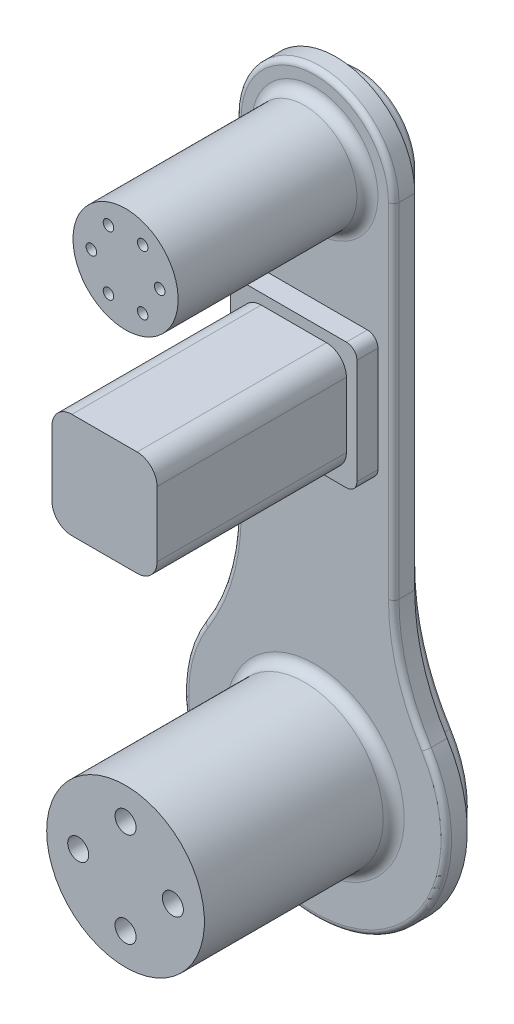
from build123d import *

# Parameters (mm, degrees)
SKETCH1_R             = 50
BOSS_EXTRUDE1_DEPTH   = 90
SKETCH1_R_2           = 75
BOSS_EXTRUDE1_2_DEPTH = 90
SKETCH2_R             = 10
SKETCH2_R_2           = 5
CUT_EXTRUDE1_DEPTH    = 40
BOSS_EXTRUDE2_DEPTH   = 20
BOSS_EXTRUDE3_DEPTH   = 20
FILLET1_R             = 19
SKETCH5_W             = 120
SKETCH5_H             = 120
BOSS_EXTRUDE4_DEPTH   = 20
SKETCH6_W             = 100
SKETCH6_H             = 100
BOSS_EXTRUDE5_DEPTH   = 180
FILLET2_R             = 19
FILLET3_R             = 10
FILLET4_R             = 10
FILLET5_R             = 5
SKETCH7_W             = 30
SKETCH7_H             = 5.384615385
BOSS_EXTRUDE6_DEPTH   = 0.1


with BuildPart() as part:
    # Sketch1 → Boss-Extrude1 (new, symmetric)
    with BuildSketch(Plane.XY):
        with Locations(Location((0, 250, 0), (0, 0, 180))):
            Circle(SKETCH1_R)
    extrude(amount=BOSS_EXTRUDE1_DEPTH, both=True)


with BuildPart() as body_2:
    # Sketch1 → Boss-Extrude1 2 (new, symmetric)
    with BuildSketch(Plane.XY):
        with Locations(Location((0, -250, 0), (0, 0, 180))):
            Circle(SKETCH1_R_2)
    extrude(amount=BOSS_EXTRUDE1_2_DEPTH, both=True)


with BuildPart() as cut_extrude1_tool:
    # Sketch2 → Cut-Extrude1 (new body)
    with BuildSketch(Plane.XY.offset(90)):
        with Locations((-45, -250)):
            Circle(SKETCH2_R)
        with Locations((0, -205)):
            Circle(SKETCH2_R)
        with Locations((45, -250)):
            Circle(SKETCH2_R)
        with Locations((0, -295)):
            Circle(SKETCH2_R)
        with Locations((-32.5, 250)):
            Circle(SKETCH2_R_2)
        with Locations((-16.25, 278.145825623)):
            Circle(SKETCH2_R_2)
        with Locations((16.25, 278.145825623)):
            Circle(SKETCH2_R_2)
        with Locations((32.5, 250)):
            Circle(SKETCH2_R_2)
        with Locations((16.25, 221.854174377)):
            Circle(SKETCH2_R_2)
        with Locations((-16.25, 221.854174377)):
            Circle(SKETCH2_R_2)
    extrude(amount=-CUT_EXTRUDE1_DEPTH)


with BuildPart() as part_1:
    add(part.part)

    # Cut-Extrude1: cut by cut_extrude1_tool
    add(cut_extrude1_tool.part, mode=Mode.SUBTRACT)



with BuildPart() as body_2_1:
    add(body_2.part)

    # Cut-Extrude1: cut by cut_extrude1_tool
    add(cut_extrude1_tool.part, mode=Mode.SUBTRACT)


with BuildPart() as part_2:
    add(part_1.part)

    add(body_2_1.part)  # Boss-Extrude2 merges body 2
    # Sketch3 → Boss-Extrude2 (add)
    with BuildSketch(Plane(origin=(0, 0, -90), x_dir=(-1, 0, 0), z_dir=(0, 0, -1))):
        with BuildLine():
            Line((-75, 250), (-75, -76.794919243))
            ThreePointArc((-75, -76.794919243), (-82.846215434, -132.264938866), (-105.769230769, -183.382661247))
            ThreePointArc((-105.769230769, -183.382661247), (0, -375), (105.769230769, -183.382661247))
            ThreePointArc((105.769230769, -183.382661247), (82.846215434, -132.264938866), (75, -76.794919243))
            Line((75, -76.794919243), (75, 250))
            ThreePointArc((75, 250), (0, 325), (-75, 250))
        make_face()
    extrude(amount=BOSS_EXTRUDE2_DEPTH)

    # Sketch4 → Boss-Extrude3 (add)
    with BuildSketch(Plane(origin=(0, 0, -110), x_dir=(-1, 0, 0), z_dir=(0, 0, -1))):
        with BuildLine():
            Line((-55, 250), (-55, -76.794919243))
            ThreePointArc((-55, -76.794919243), (-63.630836977, -137.811940828), (-88.846153846, -194.041435448))
            ThreePointArc((-88.846153846, -194.041435448), (0, -355), (88.846153846, -194.041435448))
            ThreePointArc((88.846153846, -194.041435448), (63.630836977, -137.811940828), (55, -76.794919243))
            Line((55, -76.794919243), (55, 250))
            ThreePointArc((55, 250), (0, 305), (-55, 250))
        make_face()
    extrude(amount=BOSS_EXTRUDE3_DEPTH)

    # Fillet1
    fillet1_edges = [part_2.edges().sort_by_distance(p)[0] for p in [
        (0, 305, -110),
        (55, 86.602540378, -110),
        (63.630836977, -137.811940828, -110),
        (0, -355, -110),
        (-63.630836977, -137.811940828, -110),
        (-55, 86.602540378, -110),
    ]]
    fillet(fillet1_edges, radius=FILLET1_R)

    # Sketch5 → Boss-Extrude4 (add)
    with BuildSketch(Plane.XY.offset(-90)):
        with Locations((0, 75)):
            Rectangle(SKETCH5_W, SKETCH5_H)
    extrude(amount=BOSS_EXTRUDE4_DEPTH)

    # Sketch6 → Boss-Extrude5 (add)
    with BuildSketch(Plane.XY.offset(-70)):
        with Locations((0, 75)):
            Rectangle(SKETCH6_W, SKETCH6_H)
    extrude(amount=BOSS_EXTRUDE5_DEPTH)

    # Fillet2
    fillet2_edges = [part_2.edges().sort_by_distance(p)[0] for p in [
        (-50, 25, 20),
        (50, 25, 20),
        (50, 125, 20),
        (-50, 125, 20),
    ]]
    fillet(fillet2_edges, radius=FILLET2_R)

    # Fillet3
    fillet3_edges = [part_2.edges().sort_by_distance(p)[0] for p in [
        (60, 15, -80),
        (60, 135, -80),
        (-60, 135, -80),
        (-60, 15, -80),
    ]]
    fillet(fillet3_edges, radius=FILLET3_R)

    # Fillet4
    fillet4_edges = [part_2.edges().sort_by_distance(p)[0] for p in [
        (50, 250, -90),
        (75, -250, -90),
    ]]
    fillet(fillet4_edges, radius=FILLET4_R)

    # Fillet5
    fillet5_edges = [part_2.edges().sort_by_distance(p)[0] for p in [
        (0, 325, -90),
        (75, 86.602540378, -90),
        (82.846215434, -132.264938866, -90),
        (0, -375, -90),
        (-82.846215434, -132.264938866, -90),
        (-75, 86.602540378, -90),
    ]]
    fillet(fillet5_edges, radius=FILLET5_R)

    # Sketch7 → Boss-Extrude6 (add)
    # profile 1 of 20: a face of its own
    with BuildSketch(Plane(origin=(0, 0, -130), x_dir=(-1, 0, 0), z_dir=(0, 0, -1))):
        with BuildLine():
            Line((14.327688402, 228.262161802), (10.643794171, 232.28860411))
            add(Edge.make_bspline(
                [(10.643794171, 232.28860411), (10.887132292, 232.461046445), (11.354307549, 232.79211168), (11.979183336, 233.329273303), (12.515745884, 233.863225768), (12.94865425, 234.404886272), (13.297159125, 234.944929129), (13.537536989, 235.494827833), (13.692125433, 236.048256179), (13.711281692, 236.420269874), (13.720717248, 236.603507956)],
                knots=[0, 0, 0, 0, 1.299459705, 2.494781419, 3.587730629, 4.594196874, 5.512431013, 6.380462003, 7.202284646, 8, 8, 8, 8], degree=3))
            add(Edge.make_bspline(
                [(13.720717248, 236.603507956), (13.714723626, 236.774412835), (13.703151517, 237.104385255), (13.588125612, 237.57478542), (13.389607792, 237.992413385), (13.130029042, 238.356861565), (12.817296827, 238.645558293), (12.489321145, 238.876060243), (12.127310165, 239.005852209), (11.87866642, 239.022935386), (11.755573017, 239.031392571)],
                knots=[0, 0, 0, 0, 1.185010067, 2.2879431, 3.333075148, 4.379039566, 5.372662701, 6.27520591, 7.14612461, 8, 8, 8, 8], degree=3))
            add(Edge.make_bspline(
                [(11.755573017, 239.031392571), (11.630704553, 239.026092882), (11.379236818, 239.015420043), (11.010679534, 238.912334953), (10.650556165, 238.756956288), (10.431331934, 238.608485629), (10.319274941, 238.532594494)],
                knots=[0, 0, 0, 0, 0.967525499, 1.948461899, 2.951351359, 4, 4, 4, 4], degree=3))
            add(Edge.make_bspline(
                [(10.319274941, 238.532594494), (10.232184693, 238.463591154), (10.031714444, 238.304754579), (9.713918296, 238.002165222), (9.327217397, 237.621637246), (8.873729933, 237.155355526), (8.359364181, 236.603892123), (7.781111458, 235.962366439), (7.135342251, 235.239842186), (6.685043323, 234.726874794), (6.449082633, 234.458075264)],
                knots=[0, 0, 0, 0, 0.473868417, 1.090782513, 1.870421581, 2.78911798, 3.865477667, 5.087766164, 6.473963263, 8, 8, 8, 8], degree=3))
            add(Edge.make_bspline(
                [(6.449082633, 234.458075264), (6.230680375, 234.20571826), (5.816198264, 233.726797095), (5.227907457, 233.045387383), (4.698636562, 232.446541733), (4.236328803, 231.921536332), (3.836133513, 231.478329749), (3.496137763, 231.115058742), (3.222960646, 230.827286572), (3.057961501, 230.663704942), (2.987544171, 230.593892571)],
                knots=[0, 0, 0, 0, 1.543621617, 2.929473131, 4.163658386, 5.240097082, 6.164993805, 6.925417477, 7.541396219, 8, 8, 8, 8], degree=3))
            add(Edge.make_bspline(
                [(2.987544171, 230.593892571), (2.701018696, 230.328887987), (2.15021611, 229.819456111), (1.294119375, 229.159075761), (0.464124305, 228.607294542), (-0.365271705, 228.184894207), (-1.204030905, 227.875704175), (-2.066595969, 227.649246351), (-2.967771884, 227.51552202), (-3.582527352, 227.500519287), (-3.893465444, 227.492931033)],
                knots=[0, 0, 0, 0, 1.20648512, 2.3192881, 3.339983362, 4.284774958, 5.190427137, 6.099526693, 7.038756749, 8, 8, 8, 8], degree=3))
            add(Edge.make_bspline(
                [(-3.893465444, 227.492931033), (-4.196449546, 227.498304738), (-4.79091563, 227.508848147), (-5.660868536, 227.637844871), (-6.493296904, 227.822049515), (-7.279861016, 228.105887322), (-8.029884008, 228.45474577), (-8.743611736, 228.879922209), (-9.40440547, 229.399734863), (-10.030003003, 229.97712524), (-10.591811141, 230.625648636), (-11.086121966, 231.323438532), (-11.506765207, 232.069191934), (-11.839911806, 232.865691131), (-12.107431108, 233.70806053), (-12.297527639, 234.597365031), (-12.414996788, 235.534644668), (-12.426997783, 236.174468433), (-12.433128906, 236.501344494)],
                knots=[0, 0, 0, 0, 1.043082113, 2.046565928, 3.024368146, 3.976196322, 4.921091788, 5.871642728, 6.831173094, 7.81279273, 8.801063391, 9.781590382, 10.755046466, 11.74476232, 12.751114423, 13.796272686, 14.874149815, 16, 16, 16, 16], degree=3))
            add(Edge.make_bspline(
                [(-12.433128906, 236.501344494), (-12.428578519, 236.757924459), (-12.419566145, 237.266099938), (-12.345941557, 238.015063112), (-12.227233578, 238.738312539), (-12.05669054, 239.434843832), (-11.842565518, 240.106720664), (-11.576099771, 240.753318527), (-11.262466454, 241.373952748), (-10.901487174, 241.972619611), (-10.482579565, 242.545192682), (-10.014454124, 243.099369724), (-9.486963274, 243.628228748), (-8.910394546, 244.14261666), (-8.2699719, 244.624345571), (-7.58416931, 245.098115556), (-6.836820035, 245.540993736), (-6.312644817, 245.814677767), (-6.044907752, 245.954469494)],
                knots=[0, 0, 0, 0, 1.016957334, 2.014158747, 2.980235577, 3.920141478, 4.854360818, 5.773095257, 6.689355356, 7.608638744, 8.541033765, 9.498850575, 10.481527934, 11.499755671, 12.559141621, 13.65604909, 14.802761907, 16, 16, 16, 16], degree=3))
            Line((-6.044907752, 245.954469494), (-3.202359675, 241.218892571))
            add(Edge.make_bspline(
                [(-3.202359675, 241.218892571), (-3.506285507, 241.044045623), (-4.088937304, 240.70884908), (-4.871803838, 240.140827201), (-5.542199437, 239.558917784), (-6.088274815, 238.949667605), (-6.517331701, 238.320484918), (-6.823965518, 237.668330625), (-7.013771504, 236.992746535), (-7.036951198, 236.532569344), (-7.048513521, 236.303027187)],
                knots=[0, 0, 0, 0, 1.283663364, 2.460892379, 3.537111102, 4.529833553, 5.449777664, 6.316464042, 7.160231139, 8, 8, 8, 8], degree=3))
            add(Edge.make_bspline(
                [(-7.048513521, 236.303027187), (-7.039160828, 236.069506953), (-7.02101524, 235.61644369), (-6.850102198, 234.96868925), (-6.587773223, 234.372200673), (-6.206256067, 233.859371976), (-5.771215535, 233.423881827), (-5.280558321, 233.111680146), (-4.756051837, 232.909165824), (-4.390045606, 232.888127493), (-4.205965444, 232.877546418)],
                knots=[0, 0, 0, 0, 1.13537643, 2.202795631, 3.242191317, 4.290390765, 5.297919085, 6.223733717, 7.106639842, 8, 8, 8, 8], degree=3))
            add(Edge.make_bspline(
                [(-4.205965444, 232.877546418), (-4.034794762, 232.887450607), (-3.687077907, 232.907570018), (-3.169778716, 233.05495688), (-2.654987889, 233.287300967), (-2.228273623, 233.5539431), (-1.872589537, 233.831931884), (-1.569039356, 234.104414145), (-1.226652759, 234.427352753), (-0.854766255, 234.808976363), (-0.446229652, 235.241862456), (-0.002014278, 235.727428213), (0.474258852, 236.270902724), (0.798678152, 236.655047016), (0.968313402, 236.855911802)],
                knots=[0, 0, 0, 0, 0.916057066, 1.860882232, 2.859899639, 3.934694552, 4.546382938, 5.276161949, 6.118633209, 7.067046139, 8.129668089, 9.306861125, 10.591787583, 12, 12, 12, 12], degree=3))
            add(Edge.make_bspline(
                [(0.968313402, 236.855911802), (1.291406108, 237.237749136), (1.911518804, 237.970610552), (2.827220759, 239.006426725), (3.683678238, 239.939122162), (4.487687705, 240.762554339), (5.2342889, 241.478919129), (5.916369547, 242.09689314), (6.547767247, 242.603020029), (7.296877393, 243.135086002), (8.204923209, 243.648744526), (9.303228434, 244.084422702), (10.399053091, 244.368667917), (11.134954346, 244.400393069), (11.497159556, 244.416007956)],
                knots=[0, 0, 0, 0, 1.34561873, 2.582649632, 3.719171478, 4.751946187, 5.678152813, 6.502542634, 7.227205346, 7.853698961, 8.973370308, 10.023159194, 11.027013428, 12, 12, 12, 12], degree=3))
            add(Edge.make_bspline(
                [(11.497159556, 244.416007956), (11.753998525, 244.409490082), (12.259998882, 244.39664917), (13.004083923, 244.282441403), (13.721731922, 244.110969132), (14.412724411, 243.86451858), (15.069414467, 243.534086781), (15.701907614, 243.143323007), (16.30910173, 242.684161379), (16.871198675, 242.151218587), (17.39335808, 241.573073165), (17.851696396, 240.953850805), (18.237168839, 240.300017179), (18.561628537, 239.616197323), (18.805812589, 238.893603601), (18.980446733, 238.138803005), (19.084041174, 237.351578058), (19.098147059, 236.816156773), (19.105332633, 236.543411802)],
                knots=[0, 0, 0, 0, 1.010961173, 1.991702108, 2.958025473, 3.913824419, 4.873522744, 5.847800578, 6.838738273, 7.865764422, 8.893759806, 9.903642949, 10.894078012, 11.878777586, 12.879248405, 13.891624672, 14.925988217, 16, 16, 16, 16], degree=3))
            add(Edge.make_bspline(
                [(19.105332633, 236.543411802), (19.092367135, 236.189961797), (19.066538485, 235.485851797), (18.865630042, 234.44449176), (18.546321032, 233.426854052), (18.170270145, 232.604218827), (17.794189874, 231.955445355), (17.455513984, 231.456552806), (17.065107674, 230.947912956), (16.621414933, 230.426904494), (16.127398987, 229.896175134), (15.573013913, 229.360190598), (14.976330493, 228.805894222), (14.547690166, 228.446581058), (14.327688402, 228.262161802)],
                knots=[0, 0, 0, 0, 1.282867522, 2.555608537, 3.83715526, 5.14906667, 5.830341525, 6.558732832, 7.337173124, 8.157810814, 9.043130442, 9.96912168, 10.957641678, 12, 12, 12, 12], degree=3))
        make_face()
    # profile 2 of 20: a face of its own
    with BuildSketch(Plane(origin=(0, 0, -130), x_dir=(-1, 0, 0), z_dir=(0, 0, -1))):
        with BuildLine():
            add(Edge.make_bspline(
                [(19.105332633, 208.009757956), (19.091835872, 207.488166962), (19.06519021, 206.458428201), (18.842829144, 204.944127291), (18.481142604, 203.484534115), (17.975570025, 202.079957956), (17.322972151, 200.732306594), (16.520662111, 199.445034816), (15.581129769, 198.209832303), (14.506100894, 197.049502774), (13.331355812, 195.985168369), (12.078863852, 195.049371952), (10.762599621, 194.257162028), (9.38373024, 193.609312149), (7.939384089, 193.107653274), (6.430315341, 192.757482802), (4.85930935, 192.531987739), (3.789610365, 192.50609201), (3.245957633, 192.492931033)],
                knots=[0, 0, 0, 0, 1.014244935, 2.002349224, 2.970143685, 3.935298574, 4.900830986, 5.877310296, 6.881148894, 7.915268703, 8.949887647, 9.960720774, 10.951801935, 11.933244874, 12.919141415, 13.920101769, 14.942934067, 16, 16, 16, 16], degree=3))
            add(Edge.make_bspline(
                [(3.245957633, 192.492931033), (2.70843001, 192.506946817), (1.649214585, 192.53456537), (0.092694688, 192.748292993), (-1.400240519, 193.104327436), (-2.830446634, 193.597671974), (-4.198234103, 194.233049267), (-5.50217447, 195.011275234), (-6.737297079, 195.939452004), (-7.900571267, 196.986997526), (-8.956167781, 198.140278433), (-9.888944763, 199.362245215), (-10.67368338, 200.650467809), (-11.321807334, 201.995841727), (-11.822873451, 203.404249425), (-12.176748737, 204.872493691), (-12.391723628, 206.400823274), (-12.419188342, 207.440148857), (-12.433128906, 207.967690648)],
                knots=[0, 0, 0, 0, 1.051446269, 2.071908608, 3.067230498, 4.050151293, 5.026863609, 6.012936299, 7.01551645, 8.045060801, 9.071444569, 10.070117656, 11.048150216, 12.017576978, 12.987003741, 13.967083865, 14.968130643, 16, 16, 16, 16], degree=3))
            add(Edge.make_bspline(
                [(-12.433128906, 207.967690648), (-12.420625121, 208.519437236), (-12.396056894, 209.603543865), (-12.162424272, 211.190138769), (-11.810491928, 212.71023378), (-11.285251784, 214.151059225), (-10.628657439, 215.52728868), (-9.820022138, 216.828810583), (-8.860682212, 218.055187536), (-7.775206715, 219.199384841), (-6.58745844, 220.23603037), (-5.332707715, 221.151073389), (-4.020539734, 221.922932474), (-2.650340373, 222.551635865), (-1.230625087, 223.047280364), (0.247252597, 223.396901242), (1.779748195, 223.603430638), (2.820649839, 223.632198984), (3.348121094, 223.646777187)],
                knots=[0, 0, 0, 0, 1.067978421, 2.098431617, 3.099715153, 4.085208694, 5.062210972, 6.048429807, 7.046490867, 8.072918869, 9.098532598, 10.095778865, 11.076610158, 12.041847152, 13.011192615, 13.984257998, 14.978533688, 16, 16, 16, 16], degree=3))
            add(Edge.make_bspline(
                [(3.348121094, 223.646777187), (3.702961264, 223.642139908), (4.408148514, 223.632924069), (5.453462305, 223.524296523), (6.476909827, 223.363289975), (7.480250136, 223.142509729), (8.45971511, 222.846943119), (9.41738548, 222.482957014), (10.356980848, 222.064239939), (11.269433183, 221.576287119), (12.145940354, 221.033397287), (12.982487348, 220.441149532), (13.768890765, 219.797923886), (14.510472597, 219.105922542), (15.201811489, 218.362368942), (15.855795009, 217.577230019), (16.446057732, 216.73088188), (17.00008516, 215.850849019), (17.496534714, 214.938659042), (17.924330512, 213.99953985), (18.293266929, 213.04789502), (18.586138201, 212.072294097), (18.824360483, 211.084073505), (18.981974374, 210.072894987), (19.091500721, 209.04783538), (19.100711054, 208.356604953), (19.105332633, 208.009757956)],
                knots=[0, 0, 0, 0, 1.034751683, 2.056401036, 3.062285641, 4.056148242, 5.050783641, 6.043890034, 7.043081327, 8.049576835, 9.059882113, 10.048974407, 11.037410495, 12.021414423, 13.005418351, 13.997561464, 14.999568372, 16.012961702, 17.030138968, 18.026421002, 19.021605583, 20.005054086, 20.995836695, 21.984410968, 22.988613675, 24, 24, 24, 24], degree=3))
        make_face()
        with BuildLine():
            add(Edge.make_bspline(
                [(13.720717248, 208.093892571), (13.711298372, 208.44492038), (13.692709279, 209.137708804), (13.551085878, 210.153903546), (13.324896323, 211.12948527), (12.997266663, 212.059051177), (12.580266026, 212.946610724), (12.075401919, 213.793809726), (11.465127203, 214.588641535), (10.782935356, 215.342764077), (10.019676886, 216.021692334), (9.210627194, 216.632140801), (8.336319184, 217.125713163), (7.425550198, 217.550114932), (6.455287852, 217.86360128), (5.441279426, 218.102288443), (4.373115401, 218.232293241), (3.64691906, 218.252063771), (3.27600571, 218.262161802)],
                knots=[0, 0, 0, 0, 1.033668485, 2.040047952, 3.016132939, 3.979056467, 4.937231767, 5.900589077, 6.877725736, 7.88429546, 8.891280164, 9.882584218, 10.863295226, 11.842887319, 12.837417301, 13.860812229, 14.907384602, 16, 16, 16, 16], degree=3))
            add(Edge.make_bspline(
                [(3.27600571, 218.262161802), (2.86482407, 218.249914934), (2.058976185, 218.225913102), (0.88299554, 218.058721976), (-0.225263982, 217.768335584), (-1.2696267, 217.364310178), (-2.244756483, 216.838791932), (-3.1559124, 216.20167889), (-3.998650486, 215.447318201), (-4.490955198, 214.866863776), (-4.740821213, 214.572257956)],
                knots=[0, 0, 0, 0, 1.078379799, 2.113445728, 3.107478808, 4.077334175, 5.043482131, 6.005506737, 6.987708079, 8, 8, 8, 8], degree=3))
            add(Edge.make_bspline(
                [(-4.740821213, 214.572257956), (-4.925392694, 214.330875569), (-5.290377229, 213.85354918), (-5.758179786, 213.091632342), (-6.159133243, 212.307008027), (-6.483098893, 211.493755261), (-6.737924828, 210.653591592), (-6.91637524, 209.786632233), (-7.028368306, 208.894105591), (-7.041753599, 208.290537247), (-7.048513521, 207.985719494)],
                knots=[0, 0, 0, 0, 1.023928204, 2.024787132, 3.009472467, 3.9914905, 4.972207045, 5.96565515, 6.972602802, 8, 8, 8, 8], degree=3))
            add(Edge.make_bspline(
                [(-7.048513521, 207.985719494), (-7.039015284, 207.640727231), (-7.020327203, 206.961944104), (-6.880440116, 205.964671895), (-6.643738155, 205.009230338), (-6.318885516, 204.089803982), (-5.897013317, 203.208612151), (-5.374264343, 202.370236503), (-4.765803565, 201.568544167), (-4.071849411, 200.815740514), (-3.308228971, 200.128237807), (-2.490745097, 199.526665274), (-1.62974897, 199.015662478), (-0.724622962, 198.601380794), (0.224333421, 198.27212151), (1.218460063, 198.048711857), (2.254182277, 197.904734706), (2.959008145, 197.88672251), (3.318073017, 197.877546418)],
                knots=[0, 0, 0, 0, 1.026250569, 2.01918027, 2.989144455, 3.950556051, 4.91558185, 5.889785058, 6.885144561, 7.905911388, 8.931486752, 9.937601838, 10.920932928, 11.905004308, 12.894547393, 13.903711934, 14.932071819, 16, 16, 16, 16], degree=3))
            add(Edge.make_bspline(
                [(3.318073017, 197.877546418), (3.675074851, 197.887037056), (4.377778514, 197.905717931), (5.41081389, 198.045844234), (6.400639874, 198.281070612), (7.348872955, 198.606803636), (8.256442755, 199.022747459), (9.120157722, 199.537104192), (9.939182853, 200.148069022), (10.707936807, 200.841580631), (11.414372447, 201.596425392), (12.027430166, 202.406826668), (12.560157832, 203.250108519), (12.977475174, 204.145619946), (13.309951016, 205.075039535), (13.554790996, 206.044038654), (13.691714401, 207.056287446), (13.710963458, 207.744941229), (13.720717248, 208.093892571)],
                knots=[0, 0, 0, 0, 1.055025985, 2.07665775, 3.074803781, 4.057872707, 5.035505728, 6.020516407, 7.023567878, 8.050795229, 9.077271434, 10.074415901, 11.050397877, 12.019801805, 12.988065821, 13.964604439, 14.968634123, 16, 16, 16, 16], degree=3))
        make_face(mode=Mode.SUBTRACT)
    # profile 3 of 20: a face of its own
    with BuildSketch(Plane(origin=(0, 0, -130), x_dir=(-1, 0, 0), z_dir=(0, 0, -1))):
        Polygon((18.336101864, 187.108315648), (18.336101864, 181.723700264), (-6.279282752, 181.723700264), (-6.279282752, 173.262161802), (-11.663898136, 173.262161802), (-11.663898136, 187.108315648), align=None)
    # profile 4 of 20: a face of its own
    with BuildSketch(Plane(origin=(0, 0, -130), x_dir=(-1, 0, 0), z_dir=(0, 0, -1))):
        with Locations((3.336101864, 166.723700264)):
            Rectangle(SKETCH7_W, SKETCH7_H)
    # profile 5 of 20: a face of its own
    with BuildSketch(Plane(origin=(0, 0, -130), x_dir=(-1, 0, 0), z_dir=(0, 0, -1))):
        with BuildLine():
            Line((18.336101864, 157.108315648), (18.336101864, 150.323459879))
            add(Edge.make_bspline(
                [(18.336101864, 150.323459879), (18.332404071, 149.794502415), (18.325256195, 148.772021657), (18.244723827, 147.290647969), (18.120857499, 145.913163817), (17.95050018, 144.638659632), (17.724928377, 143.46982044), (17.44245739, 142.407914446), (17.114295677, 141.448435908), (16.732932275, 140.580114235), (16.285441352, 139.78962189), (15.782762382, 139.044336658), (15.217286351, 138.335666982), (14.587714937, 137.659682253), (13.898229219, 137.014735987), (13.134947189, 136.41596751), (12.31763849, 135.844180806), (11.443466555, 135.308653148), (10.514157187, 134.831966649), (9.544337057, 134.407662221), (8.533375842, 134.054139998), (7.482669424, 133.766289652), (6.395261448, 133.537000943), (5.269079996, 133.376531685), (4.105133896, 133.277338241), (3.316271755, 133.267275144), (2.915428787, 133.262161802)],
                knots=[0, 0, 0, 0, 1.443473934, 2.790251435, 4.047465151, 5.217279069, 6.298047006, 7.293970747, 8.213772908, 9.063072335, 9.878180301, 10.689410498, 11.514196541, 12.349783386, 13.208549609, 14.087984609, 14.994942826, 15.929749014, 16.883358292, 17.843153412, 18.816615524, 19.8034191, 20.814532747, 21.847477555, 22.906243002, 24, 24, 24, 24], degree=3))
            add(Edge.make_bspline(
                [(2.915428787, 133.262161802), (2.349812523, 133.275549938), (1.2363638, 133.301905266), (-0.397599283, 133.523931829), (-1.963954594, 133.882965405), (-3.450268661, 134.388003592), (-4.843956056, 135.013406415), (-6.117098738, 135.762403513), (-7.272292095, 136.613479469), (-8.290368219, 137.574186681), (-9.170778392, 138.612755428), (-9.915993488, 139.696266109), (-10.514193909, 140.823745354), (-10.887664762, 141.819314477), (-11.122606307, 142.685004994), (-11.258363257, 143.444026792), (-11.387678267, 144.307282748), (-11.483724834, 145.280324392), (-11.571757488, 146.361889887), (-11.619001132, 147.552727539), (-11.658459082, 148.850840089), (-11.662037612, 149.752507788), (-11.663898136, 150.221296418)],
                knots=[0, 0, 0, 0, 1.315357893, 2.589359008, 3.828307697, 5.048525571, 6.235260212, 7.375784434, 8.478395391, 9.566323578, 10.624275077, 11.640246088, 12.619991216, 13.585951757, 14.107079058, 14.704817694, 15.378369799, 16.137463096, 16.978827496, 17.902494345, 18.909479843, 20, 20, 20, 20], degree=3))
            Line((-11.663898136, 150.221296418), (-11.663898136, 157.108315648))
            Line((-11.663898136, 157.108315648), (18.336101864, 157.108315648))
        make_face()
        with BuildLine():
            Line((12.951486479, 151.723700264), (-6.279282752, 151.723700264))
            Line((-6.279282752, 151.723700264), (-6.279282752, 148.911200264))
            add(Edge.make_bspline(
                [(-6.279282752, 148.911200264), (-6.278669545, 148.576555957), (-6.277490144, 147.932923551), (-6.221314255, 147.003664051), (-6.164929153, 146.144334635), (-6.057908344, 145.357300833), (-5.938694693, 144.636834862), (-5.772792576, 143.992834035), (-5.598526456, 143.412022696), (-5.376664085, 142.901495348), (-5.126943222, 142.433893888), (-4.834366275, 142.000948367), (-4.50947063, 141.583034647), (-4.142700551, 141.187966338), (-3.738913111, 140.814246752), (-3.296026425, 140.464092633), (-2.815397033, 140.132808409), (-2.294462928, 139.828983273), (-1.738806112, 139.551084178), (-1.15349524, 139.305567545), (-0.535339504, 139.098306552), (0.115387488, 138.940912022), (0.794647686, 138.806832621), (1.506808524, 138.710017011), (2.249543331, 138.657271533), (2.755092836, 138.65030941), (3.011582633, 138.646777187)],
                knots=[0, 0, 0, 0, 1.502785267, 2.890356349, 4.180881464, 5.369512404, 6.456827674, 7.458527365, 8.354953631, 9.177280646, 9.954299195, 10.732931168, 11.52132839, 12.330004022, 13.151395147, 13.990341431, 14.86389591, 15.771318928, 16.696852441, 17.652725226, 18.620174565, 19.621874256, 20.657747019, 21.729235313, 22.847930884, 24, 24, 24, 24], degree=3))
            add(Edge.make_bspline(
                [(3.011582633, 138.646777187), (3.404606948, 138.653952586), (4.17097391, 138.667944059), (5.287204117, 138.802874794), (6.338302077, 139.022516291), (7.320366881, 139.335923546), (8.236158649, 139.730983103), (9.077918683, 140.225492231), (9.859787393, 140.798169161), (10.318456666, 141.251026452), (10.547640325, 141.477306033)],
                knots=[0, 0, 0, 0, 1.13821349, 2.219428113, 3.251817212, 4.244760574, 5.201143372, 6.134805572, 7.068016741, 8, 8, 8, 8], degree=3))
            add(Edge.make_bspline(
                [(10.547640325, 141.477306033), (10.742935785, 141.700439126), (11.141804649, 142.156163202), (11.619751552, 142.956264921), (12.039674753, 143.837935578), (12.372627021, 144.821345153), (12.635939869, 145.89698943), (12.817540301, 147.071274967), (12.934234814, 148.337913212), (12.945612723, 149.215410675), (12.951486479, 149.668411802)],
                knots=[0, 0, 0, 0, 0.813307809, 1.661089106, 2.549956539, 3.493439533, 4.508053171, 5.589449661, 6.755572447, 8, 8, 8, 8], degree=3))
            Line((12.951486479, 149.668411802), (12.951486479, 151.723700264))
        make_face(mode=Mode.SUBTRACT)
    # profile 6 of 20: a face of its own
    with BuildSketch(Plane(origin=(0, 0, -130), x_dir=(-1, 0, 0), z_dir=(0, 0, -1))):
        Polygon((18.336101864, 130.762161802), (18.336101864, 125.203267571), (-0.816542367, 120.762161802), (18.336101864, 115.672017571), (18.336101864, 110.437642571), (-0.816542367, 105.377546418), (18.336101864, 100.948459879), (18.336101864, 95.377546418), (-11.663898136, 102.318652187), (-11.663898136, 107.943652187), (7.72913071, 113.06985411), (-11.663898136, 118.22610411), (-11.663898136, 123.809036802), align=None)
    # profile 7 of 20: a face of its own
    with BuildSketch(Plane(origin=(0, 0, -130), x_dir=(-1, 0, 0), z_dir=(0, 0, -1))):
        with BuildLine():
            add(Edge.make_bspline(
                [(19.105332633, 76.471296418), (19.091835872, 75.949705423), (19.06519021, 74.919966663), (18.842829144, 73.405665753), (18.481142604, 71.946072576), (17.975570025, 70.541496418), (17.322972151, 69.193845055), (16.520662111, 67.906573278), (15.581129769, 66.671370764), (14.506100894, 65.511041236), (13.331355812, 64.446706831), (12.078863852, 63.510910413), (10.762599621, 62.71870049), (9.38373024, 62.07085061), (7.939384089, 61.569191735), (6.430315341, 61.219021263), (4.85930935, 60.9935262), (3.789610365, 60.967630471), (3.245957633, 60.954469494)],
                knots=[0, 0, 0, 0, 1.014244935, 2.002349224, 2.970143685, 3.935298574, 4.900830986, 5.877310296, 6.881148894, 7.915268703, 8.949887647, 9.960720774, 10.951801935, 11.933244874, 12.919141415, 13.920101769, 14.942934067, 16, 16, 16, 16], degree=3))
            add(Edge.make_bspline(
                [(3.245957633, 60.954469494), (2.70843001, 60.968485279), (1.649214585, 60.996103832), (0.092694688, 61.209831454), (-1.400240519, 61.565865898), (-2.830446634, 62.059210436), (-4.198234103, 62.694587729), (-5.50217447, 63.472813695), (-6.737297079, 64.400990465), (-7.900571267, 65.448535988), (-8.956167781, 66.601816894), (-9.888944763, 67.823783677), (-10.67368338, 69.11200627), (-11.321807334, 70.457380188), (-11.822873451, 71.865787887), (-12.176748737, 73.334032153), (-12.391723628, 74.862361736), (-12.419188342, 75.901687318), (-12.433128906, 76.42922911)],
                knots=[0, 0, 0, 0, 1.051446269, 2.071908608, 3.067230498, 4.050151293, 5.026863609, 6.012936299, 7.01551645, 8.045060801, 9.071444569, 10.070117656, 11.048150216, 12.017576978, 12.987003741, 13.967083865, 14.968130643, 16, 16, 16, 16], degree=3))
            add(Edge.make_bspline(
                [(-12.433128906, 76.42922911), (-12.420625121, 76.980975698), (-12.396056894, 78.065082326), (-12.162424272, 79.65167723), (-11.810491928, 81.171772242), (-11.285251784, 82.612597687), (-10.628657439, 83.988827142), (-9.820022138, 85.290349044), (-8.860682212, 86.516725997), (-7.775206715, 87.660923303), (-6.58745844, 88.697568832), (-5.332707715, 89.61261185), (-4.020539734, 90.384470935), (-2.650340373, 91.013174327), (-1.230625087, 91.508818825), (0.247252597, 91.858439704), (1.779748195, 92.0649691), (2.820649839, 92.093737445), (3.348121094, 92.108315648)],
                knots=[0, 0, 0, 0, 1.067978421, 2.098431617, 3.099715153, 4.085208694, 5.062210972, 6.048429807, 7.046490867, 8.072918869, 9.098532598, 10.095778865, 11.076610158, 12.041847152, 13.011192615, 13.984257998, 14.978533688, 16, 16, 16, 16], degree=3))
            add(Edge.make_bspline(
                [(3.348121094, 92.108315648), (3.702961264, 92.103678369), (4.408148514, 92.09446253), (5.453462305, 91.985834985), (6.476909827, 91.824828436), (7.480250136, 91.60404819), (8.45971511, 91.308481581), (9.41738548, 90.944495475), (10.356980848, 90.525778401), (11.269433183, 90.037825581), (12.145940354, 89.494935748), (12.982487348, 88.902687993), (13.768890765, 88.259462347), (14.510472597, 87.567461004), (15.201811489, 86.823907403), (15.855795009, 86.03876848), (16.446057732, 85.192420342), (17.00008516, 84.312387481), (17.496534714, 83.400197503), (17.924330512, 82.461078311), (18.293266929, 81.509433481), (18.586138201, 80.533832559), (18.824360483, 79.545611967), (18.981974374, 78.534433449), (19.091500721, 77.509373842), (19.100711054, 76.818143414), (19.105332633, 76.471296418)],
                knots=[0, 0, 0, 0, 1.034751683, 2.056401036, 3.062285641, 4.056148242, 5.050783641, 6.043890034, 7.043081327, 8.049576835, 9.059882113, 10.048974407, 11.037410495, 12.021414423, 13.005418351, 13.997561464, 14.999568372, 16.012961702, 17.030138968, 18.026421002, 19.021605583, 20.005054086, 20.995836695, 21.984410968, 22.988613675, 24, 24, 24, 24], degree=3))
        make_face()
        with BuildLine():
            add(Edge.make_bspline(
                [(13.720717248, 76.555431033), (13.711298372, 76.906458841), (13.692709279, 77.599247266), (13.551085878, 78.615442008), (13.324896323, 79.591023732), (12.997266663, 80.520589639), (12.580266026, 81.408149185), (12.075401919, 82.255348187), (11.465127203, 83.050179997), (10.782935356, 83.804302539), (10.019676886, 84.483230796), (9.210627194, 85.093679263), (8.336319184, 85.587251625), (7.425550198, 86.011653394), (6.455287852, 86.325139741), (5.441279426, 86.563826904), (4.373115401, 86.693831703), (3.64691906, 86.713602232), (3.27600571, 86.723700264)],
                knots=[0, 0, 0, 0, 1.033668485, 2.040047952, 3.016132939, 3.979056467, 4.937231767, 5.900589077, 6.877725736, 7.88429546, 8.891280164, 9.882584218, 10.863295226, 11.842887319, 12.837417301, 13.860812229, 14.907384602, 16, 16, 16, 16], degree=3))
            add(Edge.make_bspline(
                [(3.27600571, 86.723700264), (2.86482407, 86.711453395), (2.058976185, 86.687451563), (0.88299554, 86.520260438), (-0.225263982, 86.229874045), (-1.2696267, 85.82584864), (-2.244756483, 85.300330394), (-3.1559124, 84.663217351), (-3.998650486, 83.908856662), (-4.490955198, 83.328402238), (-4.740821213, 83.033796418)],
                knots=[0, 0, 0, 0, 1.078379799, 2.113445728, 3.107478808, 4.077334175, 5.043482131, 6.005506737, 6.987708079, 8, 8, 8, 8], degree=3))
            add(Edge.make_bspline(
                [(-4.740821213, 83.033796418), (-4.925392694, 82.79241403), (-5.290377229, 82.315087642), (-5.758179786, 81.553170803), (-6.159133243, 80.768546488), (-6.483098893, 79.955293722), (-6.737924828, 79.115130054), (-6.91637524, 78.248170694), (-7.028368306, 77.355644052), (-7.041753599, 76.752075708), (-7.048513521, 76.447257956)],
                knots=[0, 0, 0, 0, 1.023928204, 2.024787132, 3.009472467, 3.9914905, 4.972207045, 5.96565515, 6.972602802, 8, 8, 8, 8], degree=3))
            add(Edge.make_bspline(
                [(-7.048513521, 76.447257956), (-7.039015284, 76.102265693), (-7.020327203, 75.423482565), (-6.880440116, 74.426210357), (-6.643738155, 73.4707688), (-6.318885516, 72.551342443), (-5.897013317, 71.670150613), (-5.374264343, 70.831774965), (-4.765803565, 70.030082628), (-4.071849411, 69.277278975), (-3.308228971, 68.589776269), (-2.490745097, 67.988203735), (-1.62974897, 67.47720094), (-0.724622962, 67.062919256), (0.224333421, 66.733659971), (1.218460063, 66.510250319), (2.254182277, 66.366273168), (2.959008145, 66.348260971), (3.318073017, 66.339084879)],
                knots=[0, 0, 0, 0, 1.026250569, 2.01918027, 2.989144455, 3.950556051, 4.91558185, 5.889785058, 6.885144561, 7.905911388, 8.931486752, 9.937601838, 10.920932928, 11.905004308, 12.894547393, 13.903711934, 14.932071819, 16, 16, 16, 16], degree=3))
            add(Edge.make_bspline(
                [(3.318073017, 66.339084879), (3.675074851, 66.348575518), (4.377778514, 66.367256392), (5.41081389, 66.507382695), (6.400639874, 66.742609073), (7.348872955, 67.068342097), (8.256442755, 67.48428592), (9.120157722, 67.998642654), (9.939182853, 68.609607483), (10.707936807, 69.303119092), (11.414372447, 70.057963854), (12.027430166, 70.868365129), (12.560157832, 71.71164698), (12.977475174, 72.607158408), (13.309951016, 73.536577997), (13.554790996, 74.505577116), (13.691714401, 75.517825908), (13.710963458, 76.206479691), (13.720717248, 76.555431033)],
                knots=[0, 0, 0, 0, 1.055025985, 2.07665775, 3.074803781, 4.057872707, 5.035505728, 6.020516407, 7.023567878, 8.050795229, 9.077271434, 10.074415901, 11.050397877, 12.019801805, 12.988065821, 13.964604439, 14.968634123, 16, 16, 16, 16], degree=3))
        make_face(mode=Mode.SUBTRACT)
    # profile 8 of 20: a face of its own
    with BuildSketch(Plane(origin=(0, 0, -130), x_dir=(-1, 0, 0), z_dir=(0, 0, -1))):
        with BuildLine():
            Line((18.336101864, 55.56985411), (18.336101864, 49.295815648))
            add(Edge.make_bspline(
                [(18.336101864, 49.295815648), (18.334634394, 48.881102952), (18.331812037, 48.083493618), (18.287085721, 46.933395153), (18.225129544, 45.876833968), (18.129424688, 44.910436348), (18.005666941, 44.038025864), (17.855523635, 43.257754758), (17.685902548, 42.569169941), (17.478005606, 41.962971574), (17.238589246, 41.417416817), (16.968357047, 40.910307017), (16.65709783, 40.432703257), (16.317423656, 39.975839217), (15.937168616, 39.547869682), (15.519414225, 39.149980456), (15.06717165, 38.777055356), (14.583160337, 38.428600876), (14.06805597, 38.118516189), (13.529172611, 37.843796454), (12.96505407, 37.618088393), (12.378929803, 37.430152961), (11.770094988, 37.285454117), (11.138944916, 37.187208949), (10.485211282, 37.114565645), (10.041042526, 37.110426878), (9.814467248, 37.108315648)],
                knots=[0, 0, 0, 0, 1.749037589, 3.363891962, 4.853828513, 6.212420965, 7.458679178, 8.568887289, 9.562757098, 10.447168552, 11.268163578, 12.073310924, 12.867792413, 13.67045336, 14.472446998, 15.279188696, 16.101356728, 16.943088626, 17.792208908, 18.634830833, 19.491484118, 20.351879174, 21.228996054, 22.12769993, 23.044919519, 24, 24, 24, 24], degree=3))
            add(Edge.make_bspline(
                [(9.814467248, 37.108315648), (9.577979317, 37.113835324), (9.114269587, 37.124658402), (8.433117814, 37.18295739), (7.781439441, 37.289509625), (7.161142504, 37.450898487), (6.564506683, 37.636394022), (6.002540283, 37.8830555), (5.467070317, 38.161437358), (4.965671209, 38.492063357), (4.487205885, 38.854909238), (4.050006126, 39.276891365), (3.6305741, 39.730671779), (3.255181606, 40.241759128), (2.898445961, 40.787624208), (2.575148464, 41.379112783), (2.27716216, 42.012364596), (2.110984414, 42.457571981), (2.02600571, 42.685238725)],
                knots=[0, 0, 0, 0, 1.099860209, 2.156625411, 3.176576793, 4.16617041, 5.135385252, 6.078461593, 7.016046972, 7.938469504, 8.868247731, 9.803980173, 10.76021508, 11.73834243, 12.748633912, 13.790971185, 14.870363756, 16, 16, 16, 16], degree=3))
            Line((2.02600571, 42.685238725), (-11.663898136, 35.762161802))
            Line((-11.663898136, 35.762161802), (-11.663898136, 41.747738725))
            Line((-11.663898136, 41.747738725), (1.413024941, 48.358315648))
            Line((1.413024941, 48.358315648), (1.413024941, 50.185238725))
            Line((1.413024941, 50.185238725), (-11.663898136, 50.185238725))
            Line((-11.663898136, 50.185238725), (-11.663898136, 55.56985411))
            Line((-11.663898136, 55.56985411), (18.336101864, 55.56985411))
        make_face()
        with BuildLine():
            Line((6.797640325, 50.185238725), (6.797640325, 48.087882956))
            add(Edge.make_bspline(
                [(6.797640325, 48.087882956), (6.800528248, 47.831463738), (6.806058001, 47.340476033), (6.831708205, 46.634371876), (6.893509379, 45.993058632), (6.971601021, 45.413792145), (7.061743534, 44.893625887), (7.19101008, 44.437300651), (7.329270127, 44.037464178), (7.501915052, 43.699857323), (7.694797234, 43.410236689), (7.923584015, 43.167475438), (8.174207797, 42.953611507), (8.462442967, 42.785854789), (8.776480585, 42.650318173), (9.122228969, 42.566262738), (9.493427929, 42.499572714), (9.752017898, 42.495204276), (9.886582633, 42.492931033)],
                knots=[0, 0, 0, 0, 1.688935225, 3.233948049, 4.651771667, 5.929878493, 7.083962697, 8.124219224, 9.050753627, 9.864999381, 10.615157594, 11.334035464, 12.05533055, 12.777108108, 13.522027315, 14.29964284, 15.115170198, 16, 16, 16, 16], degree=3))
            add(Edge.make_bspline(
                [(9.886582633, 42.492931033), (10.045575376, 42.499038425), (10.357887157, 42.511035266), (10.807500438, 42.630087803), (11.223672196, 42.81957893), (11.604405607, 43.07937314), (11.938527037, 43.4063487), (12.230659851, 43.780944812), (12.467046052, 44.208687602), (12.6184395, 44.607564735), (12.711495704, 44.972982479), (12.777553582, 45.301688409), (12.828772264, 45.683366039), (12.878355717, 46.115885639), (12.912485257, 46.601107235), (12.936633657, 47.138134686), (12.946653643, 47.727271501), (12.94982915, 48.13796232), (12.951486479, 48.352306033)],
                knots=[0, 0, 0, 0, 1.020213939, 2.004021227, 2.966357326, 3.948562114, 4.950324333, 5.960000531, 6.991850424, 8.080015304, 8.69218159, 9.414443227, 10.233931419, 11.166782034, 12.212677862, 13.359889063, 14.622099264, 16, 16, 16, 16], degree=3))
            Line((12.951486479, 48.352306033), (12.951486479, 50.185238725))
            Line((12.951486479, 50.185238725), (6.797640325, 50.185238725))
        make_face(mode=Mode.SUBTRACT)
    # profile 9 of 20: a face of its own
    with BuildSketch(Plane(origin=(0, 0, -130), x_dir=(-1, 0, 0), z_dir=(0, 0, -1))):
        Polygon((18.336101864, 31.339084879), (18.336101864, 25.954469494), (7.777207633, 25.954469494), (18.336101864, 17.44485411), (18.336101864, 10.64797911), (5.066871094, 21.339084879), (-11.663898136, 9.608315648), (-11.663898136, 16.092690648), (2.404611479, 25.954469494), (-11.663898136, 25.954469494), (-11.663898136, 31.339084879), align=None)
    # profile 10 of 20: a face of its own
    with BuildSketch(Plane(origin=(0, 0, -130), x_dir=(-1, 0, 0), z_dir=(0, 0, -1))):
        with BuildLine():
            Line((14.327688402, -9.814761275), (10.643794171, -5.788318967))
            add(Edge.make_bspline(
                [(10.643794171, -5.788318967), (10.887132292, -5.615876632), (11.354307549, -5.284811397), (11.979183336, -4.747649774), (12.515745884, -4.213697309), (12.94865425, -3.672036805), (13.297159125, -3.131993947), (13.537536989, -2.582095244), (13.692125433, -2.028666898), (13.711281692, -1.656653203), (13.720717248, -1.473415121)],
                knots=[0, 0, 0, 0, 1.299459705, 2.494781419, 3.587730629, 4.594196874, 5.512431013, 6.380462003, 7.202284646, 8, 8, 8, 8], degree=3))
            add(Edge.make_bspline(
                [(13.720717248, -1.473415121), (13.714723626, -1.302510242), (13.703151517, -0.972537822), (13.588125612, -0.502137657), (13.389607792, -0.084509692), (13.130029042, 0.279938488), (12.817296827, 0.568635216), (12.489321145, 0.799137166), (12.127310165, 0.928929132), (11.87866642, 0.946012309), (11.755573017, 0.954469494)],
                knots=[0, 0, 0, 0, 1.185010067, 2.2879431, 3.333075148, 4.379039566, 5.372662701, 6.27520591, 7.14612461, 8, 8, 8, 8], degree=3))
            add(Edge.make_bspline(
                [(11.755573017, 0.954469494), (11.630704553, 0.949169805), (11.379236818, 0.938496966), (11.010679534, 0.835411876), (10.650556165, 0.680033211), (10.431331934, 0.531562552), (10.319274941, 0.455671418)],
                knots=[0, 0, 0, 0, 0.967525499, 1.948461899, 2.951351359, 4, 4, 4, 4], degree=3))
            add(Edge.make_bspline(
                [(10.319274941, 0.455671418), (10.232184693, 0.386668077), (10.031714444, 0.227831502), (9.713918296, -0.074757855), (9.327217397, -0.45528583), (8.873729933, -0.921567551), (8.359364181, -1.473030954), (7.781111458, -2.114556638), (7.135342251, -2.837080891), (6.685043323, -3.350048283), (6.449082633, -3.618847813)],
                knots=[0, 0, 0, 0, 0.473868417, 1.090782513, 1.870421581, 2.78911798, 3.865477667, 5.087766164, 6.473963263, 8, 8, 8, 8], degree=3))
            add(Edge.make_bspline(
                [(6.449082633, -3.618847813), (6.230680375, -3.871204817), (5.816198264, -4.350125982), (5.227907457, -5.031535694), (4.698636562, -5.630381343), (4.236328803, -6.155386745), (3.836133513, -6.598593328), (3.496137763, -6.961864335), (3.222960646, -7.249636505), (3.057961501, -7.413218134), (2.987544171, -7.483030506)],
                knots=[0, 0, 0, 0, 1.543621617, 2.929473131, 4.163658386, 5.240097082, 6.164993805, 6.925417477, 7.541396219, 8, 8, 8, 8], degree=3))
            add(Edge.make_bspline(
                [(2.987544171, -7.483030506), (2.701018696, -7.74803509), (2.15021611, -8.257466965), (1.294119375, -8.917847316), (0.464124305, -9.469628534), (-0.365271705, -9.89202887), (-1.204030905, -10.201218902), (-2.066595969, -10.427676726), (-2.967771884, -10.561401057), (-3.582527352, -10.57640379), (-3.893465444, -10.583992044)],
                knots=[0, 0, 0, 0, 1.20648512, 2.3192881, 3.339983362, 4.284774958, 5.190427137, 6.099526693, 7.038756749, 8, 8, 8, 8], degree=3))
            add(Edge.make_bspline(
                [(-3.893465444, -10.583992044), (-4.196449546, -10.578618339), (-4.79091563, -10.56807493), (-5.660868536, -10.439078206), (-6.493296904, -10.254873562), (-7.279861016, -9.971035755), (-8.029884008, -9.622177307), (-8.743611736, -9.197000868), (-9.40440547, -8.677188214), (-10.030003003, -8.099797837), (-10.591811141, -7.451274441), (-11.086121966, -6.753484545), (-11.506765207, -6.007731143), (-11.839911806, -5.211231946), (-12.107431108, -4.368862547), (-12.297527639, -3.479558046), (-12.414996788, -2.542278409), (-12.426997783, -1.902454644), (-12.433128906, -1.575578582)],
                knots=[0, 0, 0, 0, 1.043082113, 2.046565928, 3.024368146, 3.976196322, 4.921091788, 5.871642728, 6.831173094, 7.81279273, 8.801063391, 9.781590382, 10.755046466, 11.74476232, 12.751114423, 13.796272686, 14.874149815, 16, 16, 16, 16], degree=3))
            add(Edge.make_bspline(
                [(-12.433128906, -1.575578582), (-12.428578519, -1.318998618), (-12.419566145, -0.810823139), (-12.345941557, -0.061859965), (-12.227233578, 0.661389462), (-12.05669054, 1.357920755), (-11.842565518, 2.029797587), (-11.576099771, 2.67639545), (-11.262466454, 3.297029671), (-10.901487174, 3.895696534), (-10.482579565, 4.468269605), (-10.014454124, 5.022446647), (-9.486963274, 5.551305671), (-8.910394546, 6.065693583), (-8.2699719, 6.547422495), (-7.58416931, 7.021192479), (-6.836820035, 7.464070659), (-6.312644817, 7.73775469), (-6.044907752, 7.877546418)],
                knots=[0, 0, 0, 0, 1.016957334, 2.014158747, 2.980235577, 3.920141478, 4.854360818, 5.773095257, 6.689355356, 7.608638744, 8.541033765, 9.498850575, 10.481527934, 11.499755671, 12.559141621, 13.65604909, 14.802761907, 16, 16, 16, 16], degree=3))
            Line((-6.044907752, 7.877546418), (-3.202359675, 3.141969494))
            add(Edge.make_bspline(
                [(-3.202359675, 3.141969494), (-3.506285507, 2.967122546), (-4.088937304, 2.631926003), (-4.871803838, 2.063904124), (-5.542199437, 1.481994707), (-6.088274815, 0.872744528), (-6.517331701, 0.243561841), (-6.823965518, -0.408592452), (-7.013771504, -1.084176542), (-7.036951198, -1.544353733), (-7.048513521, -1.77389589)],
                knots=[0, 0, 0, 0, 1.283663364, 2.460892379, 3.537111102, 4.529833553, 5.449777664, 6.316464042, 7.160231139, 8, 8, 8, 8], degree=3))
            add(Edge.make_bspline(
                [(-7.048513521, -1.77389589), (-7.039160828, -2.007416124), (-7.02101524, -2.460479387), (-6.850102198, -3.108233827), (-6.587773223, -3.704722404), (-6.206256067, -4.217551101), (-5.771215535, -4.65304125), (-5.280558321, -4.965242931), (-4.756051837, -5.167757253), (-4.390045606, -5.188795584), (-4.205965444, -5.199376659)],
                knots=[0, 0, 0, 0, 1.13537643, 2.202795631, 3.242191317, 4.290390765, 5.297919085, 6.223733717, 7.106639842, 8, 8, 8, 8], degree=3))
            add(Edge.make_bspline(
                [(-4.205965444, -5.199376659), (-4.034794762, -5.18947247), (-3.687077907, -5.169353059), (-3.169778716, -5.021966197), (-2.654987889, -4.78962211), (-2.228273623, -4.522979977), (-1.872589537, -4.244991193), (-1.569039356, -3.972508932), (-1.226652759, -3.649570324), (-0.854766255, -3.267946714), (-0.446229652, -2.835060621), (-0.002014278, -2.349494864), (0.474258852, -1.806020353), (0.798678152, -1.42187606), (0.968313402, -1.221011275)],
                knots=[0, 0, 0, 0, 0.916057066, 1.860882232, 2.859899639, 3.934694552, 4.546382938, 5.276161949, 6.118633209, 7.067046139, 8.129668089, 9.306861125, 10.591787583, 12, 12, 12, 12], degree=3))
            add(Edge.make_bspline(
                [(0.968313402, -1.221011275), (1.291406108, -0.839173941), (1.911518804, -0.106312525), (2.827220759, 0.929503648), (3.683678238, 1.862199085), (4.487687705, 2.685631262), (5.2342889, 3.401996052), (5.916369547, 4.019970063), (6.547767247, 4.526096952), (7.296877393, 5.058162925), (8.204923209, 5.571821449), (9.303228434, 6.007499625), (10.399053091, 6.29174484), (11.134954346, 6.323469992), (11.497159556, 6.339084879)],
                knots=[0, 0, 0, 0, 1.34561873, 2.582649632, 3.719171478, 4.751946187, 5.678152813, 6.502542634, 7.227205346, 7.853698961, 8.973370308, 10.023159194, 11.027013428, 12, 12, 12, 12], degree=3))
            add(Edge.make_bspline(
                [(11.497159556, 6.339084879), (11.753998525, 6.332567005), (12.259998882, 6.319726093), (13.004083923, 6.205518327), (13.721731922, 6.034046055), (14.412724411, 5.787595503), (15.069414467, 5.457163704), (15.701907614, 5.06639993), (16.30910173, 4.607238302), (16.871198675, 4.07429551), (17.39335808, 3.496150088), (17.851696396, 2.876927728), (18.237168839, 2.223094102), (18.561628537, 1.539274246), (18.805812589, 0.816680524), (18.980446733, 0.061879928), (19.084041174, -0.725345019), (19.098147059, -1.260766304), (19.105332633, -1.533511275)],
                knots=[0, 0, 0, 0, 1.010961173, 1.991702108, 2.958025473, 3.913824419, 4.873522744, 5.847800578, 6.838738273, 7.865764422, 8.893759806, 9.903642949, 10.894078012, 11.878777586, 12.879248405, 13.891624672, 14.925988217, 16, 16, 16, 16], degree=3))
            add(Edge.make_bspline(
                [(19.105332633, -1.533511275), (19.092367135, -1.88696128), (19.066538485, -2.59107128), (18.865630042, -3.632431317), (18.546321032, -4.650069025), (18.170270145, -5.47270425), (17.794189874, -6.121477721), (17.455513984, -6.62037027), (17.065107674, -7.129010121), (16.621414933, -7.650018582), (16.127398987, -8.180747943), (15.573013913, -8.716732479), (14.976330493, -9.271028854), (14.547690166, -9.630342019), (14.327688402, -9.814761275)],
                knots=[0, 0, 0, 0, 1.282867522, 2.555608537, 3.83715526, 5.14906667, 5.830341525, 6.558732832, 7.337173124, 8.157810814, 9.043130442, 9.96912168, 10.957641678, 12, 12, 12, 12], degree=3))
        make_face()
    # profile 11 of 20: a face of its own
    with BuildSketch(Plane(origin=(0, 0, -130), x_dir=(-1, 0, 0), z_dir=(0, 0, -1))):
        Polygon((18.336101864, -24.43014589), (18.336101864, -40.583992044), (12.951486479, -40.583992044), (12.951486479, -35.199376659), (-11.663898136, -35.199376659), (-11.663898136, -29.814761275), (12.951486479, -29.814761275), (12.951486479, -24.43014589), align=None)
    # profile 12 of 20: a face of its own
    with BuildSketch(Plane(origin=(0, 0, -130), x_dir=(-1, 0, 0), z_dir=(0, 0, -1))):
        with BuildLine():
            Line((18.336101864, -44.814761275), (18.336101864, -50.199376659))
            Line((18.336101864, -50.199376659), (-1.183128906, -50.199376659))
            add(Edge.make_bspline(
                [(-1.183128906, -50.199376659), (-1.385495824, -50.199669448), (-1.776365436, -50.200234967), (-2.337135358, -50.228545122), (-2.852600328, -50.254450867), (-3.322196024, -50.301192183), (-3.746123321, -50.370245129), (-4.127105378, -50.437110912), (-4.458321142, -50.527607137), (-4.835331396, -50.663608495), (-5.258923009, -50.873141943), (-5.700399905, -51.215507971), (-6.103311651, -51.610569079), (-6.438680122, -52.084072571), (-6.709962987, -52.616248621), (-6.910953568, -53.204173158), (-7.022677645, -53.847017417), (-7.039734371, -54.29150896), (-7.048513521, -54.520290121)],
                knots=[0, 0, 0, 0, 1.155499968, 2.231836252, 3.205919964, 4.102923608, 4.924856345, 5.658536265, 6.31071849, 6.882491295, 7.94666036, 8.992281882, 10.060072772, 11.158554251, 12.289267114, 13.461410017, 14.693379945, 16, 16, 16, 16], degree=3))
            add(Edge.make_bspline(
                [(-7.048513521, -54.520290121), (-7.04149757, -54.763370597), (-7.027817654, -55.237336371), (-6.890639715, -55.920445782), (-6.677296556, -56.555112097), (-6.366589147, -57.123994979), (-5.999809783, -57.629147081), (-5.57154993, -58.048244346), (-5.10369658, -58.393402222), (-4.663203612, -58.610366691), (-4.261624546, -58.736229022), (-3.899724842, -58.81860804), (-3.476302882, -58.889498298), (-2.99323418, -58.949862317), (-2.447388029, -58.987110896), (-1.842702739, -59.027031452), (-1.175183267, -59.041733397), (-0.710370296, -59.044229083), (-0.467984675, -59.045530506)],
                knots=[0, 0, 0, 0, 1.260838023, 2.458420682, 3.603291091, 4.724957099, 5.81103668, 6.833527554, 7.823976978, 8.819602765, 9.36572267, 10.006654001, 10.745469399, 11.594489782, 12.533565386, 13.586096035, 14.741223574, 16, 16, 16, 16], degree=3))
            Line((-0.467984675, -59.045530506), (18.336101864, -59.045530506))
            Line((18.336101864, -59.045530506), (18.336101864, -64.43014589))
            Line((18.336101864, -64.43014589), (0.439467248, -64.43014589))
            add(Edge.make_bspline(
                [(0.439467248, -64.43014589), (0.076875585, -64.429494918), (-0.62035282, -64.428243162), (-1.622212277, -64.404886648), (-2.537746476, -64.362100188), (-3.36529595, -64.308988653), (-4.107224751, -64.245297257), (-4.763154359, -64.162869493), (-5.332733181, -64.062037063), (-5.981053343, -63.910917071), (-6.727592345, -63.650476702), (-7.587192032, -63.230474414), (-8.428788225, -62.697341777), (-9.243152055, -62.067209605), (-9.999572261, -61.355683372), (-10.663962091, -60.578769947), (-11.22370496, -59.749453266), (-11.672661018, -58.86097624), (-12.019584757, -57.906994474), (-12.251583416, -56.880805356), (-12.410295883, -55.78521798), (-12.425365337, -55.029709591), (-12.433128906, -54.640482429)],
                knots=[0, 0, 0, 0, 1.170789758, 2.251314523, 3.23554622, 4.130075238, 4.928857907, 5.639700176, 6.263954887, 6.795817153, 7.787924184, 8.809125334, 9.87873356, 10.999178519, 12.129364722, 13.22595565, 14.293390689, 15.352147651, 16.432536881, 17.562186165, 18.74407303, 20, 20, 20, 20], degree=3))
            add(Edge.make_bspline(
                [(-12.433128906, -54.640482429), (-12.428772583, -54.381878281), (-12.420177649, -53.871657603), (-12.344407784, -53.121284522), (-12.232716861, -52.395917101), (-12.069896548, -51.69684581), (-11.859121561, -51.021908571), (-11.601937183, -50.371988096), (-11.292303353, -49.751252773), (-10.944120077, -49.157523074), (-10.562466999, -48.593818491), (-10.14642276, -48.073334844), (-9.713823814, -47.588781871), (-9.255726384, -47.148875594), (-8.773842147, -46.750776442), (-8.267614836, -46.394879716), (-7.7369489, -46.081825551), (-7.172316427, -45.803709625), (-6.545009095, -45.565671062), (-5.83271615, -45.364995161), (-5.024272264, -45.189680117), (-4.11785632, -45.05939628), (-3.116455682, -44.941280202), (-2.017461574, -44.866519234), (-0.820842457, -44.827408408), (0.00874877, -44.819083509), (0.439467248, -44.814761275)],
                knots=[0, 0, 0, 0, 1.001195678, 1.975338534, 2.91783225, 3.841754112, 4.752027347, 5.653798756, 6.545402703, 7.435486725, 8.317659034, 9.179053568, 10.013983148, 10.831468265, 11.636005169, 12.432309474, 13.225243684, 14.019732185, 14.86686161, 15.819485008, 16.883051984, 18.067941734, 19.364090787, 20.787286826, 22.331979793, 24, 24, 24, 24], degree=3))
            Line((0.439467248, -44.814761275), (18.336101864, -44.814761275))
        make_face()
    # profile 13 of 20: a face of its own
    with BuildSketch(Plane(origin=(0, 0, -130), x_dir=(-1, 0, 0), z_dir=(0, 0, -1))):
        Polygon((18.336101864, -68.276299736), (18.336101864, -84.43014589), (12.951486479, -84.43014589), (12.951486479, -79.045530506), (-11.663898136, -79.045530506), (-11.663898136, -73.660915121), (12.951486479, -73.660915121), (12.951486479, -68.276299736), align=None)
    # profile 14 of 20: a face of its own
    with BuildSketch(Plane(origin=(0, 0, -130), x_dir=(-1, 0, 0), z_dir=(0, 0, -1))):
        with BuildLine():
            add(Edge.make_bspline(
                [(19.105332633, -102.759472813), (19.091835872, -103.281063807), (19.06519021, -104.310802568), (18.842829144, -105.825103478), (18.481142604, -107.284696655), (17.975570025, -108.689272813), (17.322972151, -110.036924176), (16.520662111, -111.324195953), (15.581129769, -112.559398466), (14.506100894, -113.719727995), (13.331355812, -114.7840624), (12.078863852, -115.719858818), (10.762599621, -116.512068741), (9.38373024, -117.159918621), (7.939384089, -117.661577495), (6.430315341, -118.011747968), (4.85930935, -118.237243031), (3.789610365, -118.263138759), (3.245957633, -118.276299736)],
                knots=[0, 0, 0, 0, 1.014244935, 2.002349224, 2.970143685, 3.935298574, 4.900830986, 5.877310296, 6.881148894, 7.915268703, 8.949887647, 9.960720774, 10.951801935, 11.933244874, 12.919141415, 13.920101769, 14.942934067, 16, 16, 16, 16], degree=3))
            add(Edge.make_bspline(
                [(3.245957633, -118.276299736), (2.70843001, -118.262283952), (1.649214585, -118.234665399), (0.092694688, -118.020937776), (-1.400240519, -117.664903333), (-2.830446634, -117.171558795), (-4.198234103, -116.536181502), (-5.50217447, -115.757955535), (-6.737297079, -114.829778766), (-7.900571267, -113.782233243), (-8.956167781, -112.628952337), (-9.888944763, -111.406985554), (-10.67368338, -110.118762961), (-11.321807334, -108.773389042), (-11.822873451, -107.364981344), (-12.176748737, -105.896737078), (-12.391723628, -104.368407495), (-12.419188342, -103.329081913), (-12.433128906, -102.801540121)],
                knots=[0, 0, 0, 0, 1.051446269, 2.071908608, 3.067230498, 4.050151293, 5.026863609, 6.012936299, 7.01551645, 8.045060801, 9.071444569, 10.070117656, 11.048150216, 12.017576978, 12.987003741, 13.967083865, 14.968130643, 16, 16, 16, 16], degree=3))
            add(Edge.make_bspline(
                [(-12.433128906, -102.801540121), (-12.420625121, -102.249793533), (-12.396056894, -101.165686904), (-12.162424272, -99.579092001), (-11.810491928, -98.058996989), (-11.285251784, -96.618171544), (-10.628657439, -95.241942089), (-9.820022138, -93.940420187), (-8.860682212, -92.714043233), (-7.775206715, -91.569845928), (-6.58745844, -90.533200399), (-5.332707715, -89.61815738), (-4.020539734, -88.846298296), (-2.650340373, -88.217594904), (-1.230625087, -87.721950405), (0.247252597, -87.372329527), (1.779748195, -87.165800131), (2.820649839, -87.137031785), (3.348121094, -87.122453582)],
                knots=[0, 0, 0, 0, 1.067978421, 2.098431617, 3.099715153, 4.085208694, 5.062210972, 6.048429807, 7.046490867, 8.072918869, 9.098532598, 10.095778865, 11.076610158, 12.041847152, 13.011192615, 13.984257998, 14.978533688, 16, 16, 16, 16], degree=3))
            add(Edge.make_bspline(
                [(3.348121094, -87.122453582), (3.702961264, -87.127090861), (4.408148514, -87.1363067), (5.453462305, -87.244934246), (6.476909827, -87.405940794), (7.480250136, -87.626721041), (8.45971511, -87.92228765), (9.41738548, -88.286273755), (10.356980848, -88.70499083), (11.269433183, -89.19294365), (12.145940354, -89.735833483), (12.982487348, -90.328081237), (13.768890765, -90.971306883), (14.510472597, -91.663308227), (15.201811489, -92.406861828), (15.855795009, -93.19200075), (16.446057732, -94.038348889), (17.00008516, -94.91838175), (17.496534714, -95.830571728), (17.924330512, -96.769690919), (18.293266929, -97.72133575), (18.586138201, -98.696936672), (18.824360483, -99.685157264), (18.981974374, -100.696335782), (19.091500721, -101.721395389), (19.100711054, -102.412625817), (19.105332633, -102.759472813)],
                knots=[0, 0, 0, 0, 1.034751683, 2.056401036, 3.062285641, 4.056148242, 5.050783641, 6.043890034, 7.043081327, 8.049576835, 9.059882113, 10.048974407, 11.037410495, 12.021414423, 13.005418351, 13.997561464, 14.999568372, 16.012961702, 17.030138968, 18.026421002, 19.021605583, 20.005054086, 20.995836695, 21.984410968, 22.988613675, 24, 24, 24, 24], degree=3))
        make_face()
        with BuildLine():
            add(Edge.make_bspline(
                [(13.720717248, -102.675338198), (13.711298372, -102.32431039), (13.692709279, -101.631521965), (13.551085878, -100.615327223), (13.324896323, -99.639745499), (12.997266663, -98.710179592), (12.580266026, -97.822620046), (12.075401919, -96.975421043), (11.465127203, -96.180589234), (10.782935356, -95.426466692), (10.019676886, -94.747538435), (9.210627194, -94.137089968), (8.336319184, -93.643517606), (7.425550198, -93.219115837), (6.455287852, -92.90562949), (5.441279426, -92.666942327), (4.373115401, -92.536937528), (3.64691906, -92.517166998), (3.27600571, -92.507068967)],
                knots=[0, 0, 0, 0, 1.033668485, 2.040047952, 3.016132939, 3.979056467, 4.937231767, 5.900589077, 6.877725736, 7.88429546, 8.891280164, 9.882584218, 10.863295226, 11.842887319, 12.837417301, 13.860812229, 14.907384602, 16, 16, 16, 16], degree=3))
            add(Edge.make_bspline(
                [(3.27600571, -92.507068967), (2.86482407, -92.519315835), (2.058976185, -92.543317668), (0.88299554, -92.710508793), (-0.225263982, -93.000895185), (-1.2696267, -93.404920591), (-2.244756483, -93.930438837), (-3.1559124, -94.567551879), (-3.998650486, -95.321912569), (-4.490955198, -95.902366993), (-4.740821213, -96.196972813)],
                knots=[0, 0, 0, 0, 1.078379799, 2.113445728, 3.107478808, 4.077334175, 5.043482131, 6.005506737, 6.987708079, 8, 8, 8, 8], degree=3))
            add(Edge.make_bspline(
                [(-4.740821213, -96.196972813), (-4.925392694, -96.438355201), (-5.290377229, -96.915681589), (-5.758179786, -97.677598427), (-6.159133243, -98.462222742), (-6.483098893, -99.275475508), (-6.737924828, -100.115639177), (-6.91637524, -100.982598537), (-7.028368306, -101.875125179), (-7.041753599, -102.478693522), (-7.048513521, -102.783511275)],
                knots=[0, 0, 0, 0, 1.023928204, 2.024787132, 3.009472467, 3.9914905, 4.972207045, 5.96565515, 6.972602802, 8, 8, 8, 8], degree=3))
            add(Edge.make_bspline(
                [(-7.048513521, -102.783511275), (-7.039015284, -103.128503538), (-7.020327203, -103.807286665), (-6.880440116, -104.804558874), (-6.643738155, -105.760000431), (-6.318885516, -106.679426788), (-5.897013317, -107.560618618), (-5.374264343, -108.398994266), (-4.765803565, -109.200686603), (-4.071849411, -109.953490255), (-3.308228971, -110.640992962), (-2.490745097, -111.242565496), (-1.62974897, -111.753568291), (-0.724622962, -112.167849975), (0.224333421, -112.497109259), (1.218460063, -112.720518912), (2.254182277, -112.864496063), (2.959008145, -112.88250826), (3.318073017, -112.891684352)],
                knots=[0, 0, 0, 0, 1.026250569, 2.01918027, 2.989144455, 3.950556051, 4.91558185, 5.889785058, 6.885144561, 7.905911388, 8.931486752, 9.937601838, 10.920932928, 11.905004308, 12.894547393, 13.903711934, 14.932071819, 16, 16, 16, 16], degree=3))
            add(Edge.make_bspline(
                [(3.318073017, -112.891684352), (3.675074851, -112.882193713), (4.377778514, -112.863512839), (5.41081389, -112.723386535), (6.400639874, -112.488160158), (7.348872955, -112.162427134), (8.256442755, -111.746483311), (9.120157722, -111.232126577), (9.939182853, -110.621161747), (10.707936807, -109.927650139), (11.414372447, -109.172805377), (12.027430166, -108.362404102), (12.560157832, -107.51912225), (12.977475174, -106.623610823), (13.309951016, -105.694191234), (13.554790996, -104.725192115), (13.691714401, -103.712943323), (13.710963458, -103.02428954), (13.720717248, -102.675338198)],
                knots=[0, 0, 0, 0, 1.055025985, 2.07665775, 3.074803781, 4.057872707, 5.035505728, 6.020516407, 7.023567878, 8.050795229, 9.077271434, 10.074415901, 11.050397877, 12.019801805, 12.988065821, 13.964604439, 14.968634123, 16, 16, 16, 16], degree=3))
        make_face(mode=Mode.SUBTRACT)
    # profile 15 of 20: a face of its own
    with BuildSketch(Plane(origin=(0, 0, -130), x_dir=(-1, 0, 0), z_dir=(0, 0, -1))):
        with BuildLine():
            Line((18.336101864, -123.660915121), (18.336101864, -129.934953582))
            add(Edge.make_bspline(
                [(18.336101864, -129.934953582), (18.334634394, -130.349666279), (18.331812037, -131.147275612), (18.287085721, -132.297374078), (18.225129544, -133.353935263), (18.129424688, -134.320332883), (18.005666941, -135.192743367), (17.855523635, -135.973014473), (17.685902548, -136.66159929), (17.478005606, -137.267797657), (17.238589246, -137.813352414), (16.968357047, -138.320462213), (16.65709783, -138.798065974), (16.317423656, -139.254930014), (15.937168616, -139.682899549), (15.519414225, -140.080788775), (15.06717165, -140.453713875), (14.583160337, -140.802168355), (14.06805597, -141.112253042), (13.529172611, -141.386972777), (12.96505407, -141.612680838), (12.378929803, -141.80061627), (11.770094988, -141.945315114), (11.138944916, -142.043560282), (10.485211282, -142.116203586), (10.041042526, -142.120342353), (9.814467248, -142.122453582)],
                knots=[0, 0, 0, 0, 1.749037589, 3.363891962, 4.853828513, 6.212420965, 7.458679178, 8.568887289, 9.562757098, 10.447168552, 11.268163578, 12.073310924, 12.867792413, 13.67045336, 14.472446998, 15.279188696, 16.101356728, 16.943088626, 17.792208908, 18.634830833, 19.491484118, 20.351879174, 21.228996054, 22.12769993, 23.044919519, 24, 24, 24, 24], degree=3))
            add(Edge.make_bspline(
                [(9.814467248, -142.122453582), (9.577979317, -142.116933907), (9.114269587, -142.106110828), (8.433117814, -142.047811841), (7.781439441, -141.941259605), (7.161142504, -141.779870743), (6.564506683, -141.594375209), (6.002540283, -141.347713731), (5.467070317, -141.069331873), (4.965671209, -140.738705874), (4.487205885, -140.375859993), (4.050006126, -139.953877865), (3.6305741, -139.500097452), (3.255181606, -138.989010103), (2.898445961, -138.443145023), (2.575148464, -137.851656448), (2.27716216, -137.218404635), (2.110984414, -136.77319725), (2.02600571, -136.545530506)],
                knots=[0, 0, 0, 0, 1.099860209, 2.156625411, 3.176576793, 4.16617041, 5.135385252, 6.078461593, 7.016046972, 7.938469504, 8.868247731, 9.803980173, 10.76021508, 11.73834243, 12.748633912, 13.790971185, 14.870363756, 16, 16, 16, 16], degree=3))
            Line((2.02600571, -136.545530506), (-11.663898136, -143.468607429))
            Line((-11.663898136, -143.468607429), (-11.663898136, -137.483030506))
            Line((-11.663898136, -137.483030506), (1.413024941, -130.872453582))
            Line((1.413024941, -130.872453582), (1.413024941, -129.045530506))
            Line((1.413024941, -129.045530506), (-11.663898136, -129.045530506))
            Line((-11.663898136, -129.045530506), (-11.663898136, -123.660915121))
            Line((-11.663898136, -123.660915121), (18.336101864, -123.660915121))
        make_face()
        with BuildLine():
            Line((6.797640325, -129.045530506), (6.797640325, -131.142886275))
            add(Edge.make_bspline(
                [(6.797640325, -131.142886275), (6.800528248, -131.399305493), (6.806058001, -131.890293198), (6.831708205, -132.596397355), (6.893509379, -133.237710599), (6.971601021, -133.816977085), (7.061743534, -134.337143343), (7.19101008, -134.79346858), (7.329270127, -135.193305053), (7.501915052, -135.530911908), (7.694797234, -135.820532542), (7.923584015, -136.063293793), (8.174207797, -136.277157724), (8.462442967, -136.444914442), (8.776480585, -136.580451058), (9.122228969, -136.664506492), (9.493427929, -136.731196517), (9.752017898, -136.735564955), (9.886582633, -136.737838198)],
                knots=[0, 0, 0, 0, 1.688935225, 3.233948049, 4.651771667, 5.929878493, 7.083962697, 8.124219224, 9.050753627, 9.864999381, 10.615157594, 11.334035464, 12.05533055, 12.777108108, 13.522027315, 14.29964284, 15.115170198, 16, 16, 16, 16], degree=3))
            add(Edge.make_bspline(
                [(9.886582633, -136.737838198), (10.045575376, -136.731730805), (10.357887157, -136.719733965), (10.807500438, -136.600681428), (11.223672196, -136.411190301), (11.604405607, -136.15139609), (11.938527037, -135.824420531), (12.230659851, -135.449824419), (12.467046052, -135.022081628), (12.6184395, -134.623204495), (12.711495704, -134.257786752), (12.777553582, -133.929080822), (12.828772264, -133.547403191), (12.878355717, -133.114883592), (12.912485257, -132.629661996), (12.936633657, -132.092634545), (12.946653643, -131.503497729), (12.94982915, -131.092806911), (12.951486479, -130.878463198)],
                knots=[0, 0, 0, 0, 1.020213939, 2.004021227, 2.966357326, 3.948562114, 4.950324333, 5.960000531, 6.991850424, 8.080015304, 8.69218159, 9.414443227, 10.233931419, 11.166782034, 12.212677862, 13.359889063, 14.622099264, 16, 16, 16, 16], degree=3))
            Line((12.951486479, -130.878463198), (12.951486479, -129.045530506))
            Line((12.951486479, -129.045530506), (6.797640325, -129.045530506))
        make_face(mode=Mode.SUBTRACT)
    # profile 16 of 20: a face of its own
    with BuildSketch(Plane(origin=(0, 0, -130), x_dir=(-1, 0, 0), z_dir=(0, 0, -1))):
        with Locations((3.336101864, -149.814761275)):
            Rectangle(SKETCH7_W, SKETCH7_H)
    # profile 17 of 20: a face of its own
    with BuildSketch(Plane(origin=(0, 0, -130), x_dir=(-1, 0, 0), z_dir=(0, 0, -1))):
        Polygon((18.336101864, -168.666924736), (18.336101864, -173.660915121), (-11.663898136, -185.776299736), (-11.663898136, -180.025097813), (-5.510051983, -177.693367044), (-5.510051983, -164.622453582), (-11.663898136, -162.290722813), (-11.663898136, -156.545530506), align=None)
        Polygon((10.289226864, -171.160915121), (-0.125436598, -166.665722813), (-0.125436598, -175.656107429), align=None, mode=Mode.SUBTRACT)
    # profile 18 of 20: a face of its own
    with BuildSketch(Plane(origin=(0, 0, -130), x_dir=(-1, 0, 0), z_dir=(0, 0, -1))):
        Polygon((18.336101864, -190.199376659), (18.336101864, -195.583992044), (-6.279282752, -195.583992044), (-6.279282752, -204.045530506), (-11.663898136, -204.045530506), (-11.663898136, -190.199376659), align=None)
    # profile 19 of 20: a face of its own
    with BuildSketch(Plane(origin=(0, 0, -130), x_dir=(-1, 0, 0), z_dir=(0, 0, -1))):
        Polygon((18.336101864, -220.199376659), (18.336101864, -225.583992044), (6.797640325, -225.583992044), (6.797640325, -235.968607429), (18.336101864, -235.968607429), (18.336101864, -241.353222813), (-11.663898136, -241.353222813), (-11.663898136, -235.968607429), (1.413024941, -235.968607429), (1.413024941, -225.583992044), (-11.663898136, -225.583992044), (-11.663898136, -220.199376659), align=None)
    # profile 20 of 20: a face of its own
    with BuildSketch(Plane(origin=(0, 0, -130), x_dir=(-1, 0, 0), z_dir=(0, 0, -1))):
        with BuildLine():
            Line((18.336101864, -248.276299736), (18.336101864, -254.285915121))
            add(Edge.make_bspline(
                [(18.336101864, -254.285915121), (18.334344232, -254.678575594), (18.330953392, -255.436099953), (18.289834943, -256.528512404), (18.216148178, -257.536316376), (18.12508299, -258.45928033), (17.99741314, -259.297024765), (17.851049653, -260.050598789), (17.672736327, -260.720158787), (17.461080881, -261.313255042), (17.211547379, -261.845539773), (16.945776388, -262.349252806), (16.628588083, -262.813010171), (16.294167674, -263.260219104), (15.910568106, -263.665311897), (15.503318489, -264.053560666), (15.056267636, -264.408522015), (14.574826978, -264.731840704), (14.067891481, -265.025140574), (13.534554892, -265.281386962), (12.973973264, -265.489239682), (12.389772922, -265.663602269), (11.781979327, -265.803651997), (11.146854493, -265.896873555), (10.488833105, -265.960194326), (10.040983333, -265.96578151), (9.814467248, -265.968607429)],
                knots=[0, 0, 0, 0, 1.698747864, 3.27724071, 4.728299578, 6.070144658, 7.288476769, 8.393259625, 9.389771311, 10.283485332, 11.113357557, 11.931608583, 12.74405601, 13.541433047, 14.344816069, 15.154114104, 15.974336324, 16.810834471, 17.661136416, 18.50621059, 19.367396281, 20.244825668, 21.142564693, 22.063065223, 23.020325768, 24, 24, 24, 24], degree=3))
            add(Edge.make_bspline(
                [(9.814467248, -265.968607429), (9.563870637, -265.964536404), (9.071417501, -265.95653634), (8.349665378, -265.877517382), (7.661071615, -265.743861244), (7.00269495, -265.564932874), (6.375974214, -265.331546574), (5.785031914, -265.039032463), (5.222442996, -264.704447059), (4.698571784, -264.309415565), (4.210471161, -263.873052693), (3.753872634, -263.402643228), (3.344370563, -262.887524353), (2.974153456, -262.33487418), (2.635507648, -261.74926638), (2.333159002, -261.128015652), (2.073954127, -260.466735064), (1.938453813, -260.006188956), (1.86975571, -259.772693967)],
                knots=[0, 0, 0, 0, 1.101807132, 2.165186409, 3.188051288, 4.184043032, 5.162581952, 6.123956752, 7.080353552, 8.037115474, 9.004325744, 9.957633715, 10.916623919, 11.894012059, 12.880765509, 13.889456409, 14.929963055, 16, 16, 16, 16], degree=3))
            add(Edge.make_bspline(
                [(1.86975571, -259.772693967), (1.831492393, -259.618903502), (1.748601728, -259.285743832), (1.664446898, -258.734456084), (1.587071706, -258.099154838), (1.520577096, -257.377785747), (1.475376255, -256.569932927), (1.440076408, -255.67637859), (1.414409774, -254.696717791), (1.413499009, -254.015500411), (1.413024941, -253.660915121)],
                knots=[0, 0, 0, 0, 0.618981996, 1.340914327, 2.176866532, 3.120127938, 4.170906482, 5.338178032, 6.614476169, 8, 8, 8, 8], degree=3))
            Line((1.413024941, -253.660915121), (-11.663898136, -253.660915121))
            Line((-11.663898136, -253.660915121), (-11.663898136, -248.276299736))
            Line((-11.663898136, -248.276299736), (18.336101864, -248.276299736))
        make_face()
        with BuildLine():
            Line((6.797640325, -253.660915121), (6.797640325, -255.565963198))
            add(Edge.make_bspline(
                [(6.797640325, -255.565963198), (6.799830547, -255.912622028), (6.803860589, -256.550479426), (6.862434761, -257.42149438), (6.95150763, -258.12167172), (7.080256481, -258.674261307), (7.272091802, -259.110626285), (7.50307305, -259.482875461), (7.781056848, -259.810886697), (8.10878533, -260.090250938), (8.481730623, -260.314208197), (8.897593433, -260.469164238), (9.346921009, -260.569911521), (9.659651338, -260.579210121), (9.820476864, -260.583992044)],
                knots=[0, 0, 0, 0, 1.86206948, 3.426235505, 4.686422206, 5.652169143, 6.46188206, 7.235309636, 7.998714295, 8.762118954, 9.539132074, 10.32260217, 11.137376956, 12, 12, 12, 12], degree=3))
            add(Edge.make_bspline(
                [(9.820476864, -260.583992044), (9.960985906, -260.579257358), (10.23360723, -260.570070929), (10.627067423, -260.502584917), (10.993853489, -260.395031627), (11.330134834, -260.239191044), (11.635340063, -260.037726072), (11.909348945, -259.792099501), (12.158029611, -259.505463203), (12.289660086, -259.284163223), (12.356534556, -259.171732429)],
                knots=[0, 0, 0, 0, 1.102301479, 2.1387299, 3.123554645, 4.094223062, 5.036071848, 5.982632524, 6.975082478, 8, 8, 8, 8], degree=3))
            add(Edge.make_bspline(
                [(12.356534556, -259.171732429), (12.404697815, -259.076497056), (12.506669304, -258.874864256), (12.625218615, -258.531464049), (12.725228019, -258.135185454), (12.808234858, -257.683353144), (12.872656786, -257.177769608), (12.921923445, -256.61852505), (12.941735487, -256.004796489), (12.948146499, -255.577984997), (12.951486479, -255.355626659)],
                knots=[0, 0, 0, 0, 0.656809284, 1.390599849, 2.23162475, 3.173112763, 4.218524733, 5.370385145, 6.63003504, 8, 8, 8, 8], degree=3))
            Line((12.951486479, -255.355626659), (12.951486479, -253.660915121))
            Line((12.951486479, -253.660915121), (6.797640325, -253.660915121))
        make_face(mode=Mode.SUBTRACT)
    extrude(amount=BOSS_EXTRUDE6_DEPTH)


solid = part_2.part
